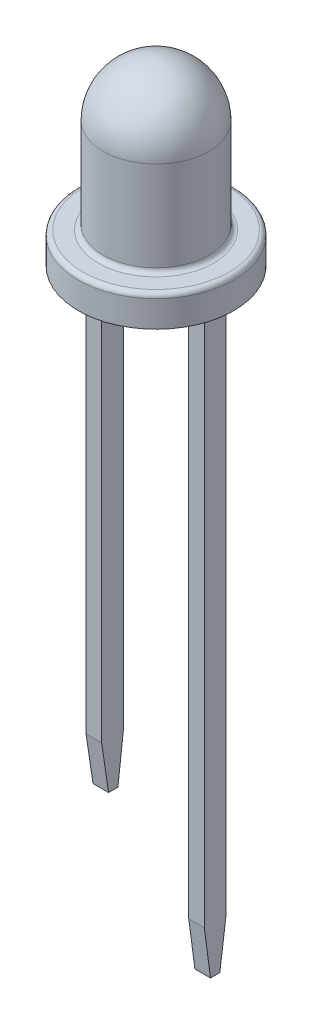
from build123d import *

# Parameters (mm, degrees)
BOSS_EXTRUDE1_DEPTH = 0.35
BOSS_EXTRUDE2_DEPTH = 0.35
CUT_EXTRUDE1_DEPTH  = 0.7
CUT_EXTRUDE2_DEPTH  = 0.7


with BuildPart() as part:
    # Sketch1 → Boss-Extrude1 (new, symmetric)
    with BuildSketch(Plane.XY):
        with BuildLine():
            Line((0, 0), (0, 19.4))
            ThreePointArc((0, 19.4), (-0.029289322, 19.470710678), (-0.1, 19.5))
            Line((-0.1, 19.5), (-0.4, 19.5))
            ThreePointArc((-0.4, 19.5), (-0.470710678, 19.529289322), (-0.5, 19.6))
            Line((-0.5, 19.6), (-0.5, 20.5))
            Line((-0.5, 20.5), (-0.5, 21))
            Line((-0.5, 21), (-1, 21))
            Line((-1, 21), (-1, 20.5))
            Line((-1, 20.5), (-2, 19.5))
            Line((-2, 19.5), (-1.1, 19.5))
            ThreePointArc((-1.1, 19.5), (-1.029289322, 19.470710678), (-1, 19.4))
            Line((-1, 19.4), (-1, 19.1))
            ThreePointArc((-1, 19.1), (-0.970710678, 19.029289322), (-0.9, 19))
            Line((-0.9, 19), (-0.6, 19))
            ThreePointArc((-0.6, 19), (-0.529289322, 18.970710678), (-0.5, 18.9))
            Line((-0.5, 18.9), (-0.5, 0))
            Line((-0.5, 0), (0, 0))
        make_face()
    extrude(amount=BOSS_EXTRUDE1_DEPTH, both=True)


with BuildPart() as body_2:
    # Sketch2 → Boss-Extrude2 (new, symmetric)
    with BuildSketch(Plane.XY):
        with BuildLine():
            Line((-2.270710678, 19.529289322), (-1.329289322, 20.470710678))
            ThreePointArc((-1.329289322, 20.470710678), (-1.307612047, 20.503153013), (-1.3, 20.541421356))
            Line((-1.3, 20.541421356), (-1.3, 21))
            Line((-1.3, 21), (-3.3, 21))
            Line((-3.3, 21), (-3.3, 19.6))
            ThreePointArc((-3.3, 19.6), (-3.329289322, 19.529289322), (-3.4, 19.5))
            Line((-3.4, 19.5), (-3.7, 19.5))
            ThreePointArc((-3.7, 19.5), (-3.770710678, 19.470710678), (-3.8, 19.4))
            Line((-3.8, 19.4), (-3.8, 3.5))
            Line((-3.8, 3.5), (-3.3, 3.5))
            Line((-3.3, 3.5), (-3.3, 18.817329295))
            ThreePointArc((-3.3, 18.817329295), (-3.270710678, 18.888039973), (-3.2, 18.917329295))
            Line((-3.2, 18.917329295), (-2.9, 18.917329295))
            ThreePointArc((-2.9, 18.917329295), (-2.829289322, 18.946618617), (-2.8, 19.017329295))
            Line((-2.8, 19.017329295), (-2.8, 19.4))
            ThreePointArc((-2.8, 19.4), (-2.770710678, 19.470710678), (-2.7, 19.5))
            Line((-2.7, 19.5), (-2.341421356, 19.5))
            ThreePointArc((-2.341421356, 19.5), (-2.303153013, 19.507612047), (-2.270710678, 19.529289322))
        make_face()
    extrude(amount=BOSS_EXTRUDE2_DEPTH, both=True)


with BuildPart() as cut_revolve2_tool:
    # Sketch3 → Cut-Revolve2 (revolve)
    with BuildSketch(Plane.XY):
        with BuildLine():
            Line((-1.187247292, 20.854394701), (-1.187247292, 21.16036165))
            Line((-1.187247292, 21.16036165), (-0.687247292, 21.037131329))
            ThreePointArc((-0.687247292, 21.037131329), (-0.920585717, 20.900173974), (-1.187247292, 20.854394701))
        make_face()
    revolve(axis=Axis((-1.187247292, 20.854394701, 0), (0, 1, 0)))


with BuildPart() as part_1:
    add(part.part)

    # Cut-Revolve2: cut by cut_revolve2_tool
    add(cut_revolve2_tool.part, mode=Mode.SUBTRACT)



with BuildPart() as body_2_1:
    add(body_2.part)

    # Cut-Revolve2: cut by cut_revolve2_tool
    add(cut_revolve2_tool.part, mode=Mode.SUBTRACT)


with BuildPart() as part_2:
    add(part_1.part)

    add(body_2_1.part)  # Revolve2 merges body 2
    # Sketch5 → Revolve2 (revolve)
    with BuildSketch(Plane.XY):
        with BuildLine():
            Line((-1.187247292, 20.967936142), (-1.187247292, 20.854394701))
            ThreePointArc((-1.187247292, 20.854394701), (-0.920585717, 20.900173974), (-0.687247292, 21.037131329))
            add(Edge.make_bspline(
                [(-1.187247292, 20.967936142), (-1.018996559, 20.969146878), (-0.855677822, 21.018217253), (-0.687247292, 21.037131329)],
                knots=[0, 0, 0, 0, 1, 1, 1, 1], degree=3))
        make_face()
    revolve(axis=Axis((-1.187247292, 20.967936142, 0), (0, -1, 0)))

    # Sketch8 → Cut-Extrude1 (cut)
    with BuildSketch(Plane(origin=(0, 0, 0), x_dir=(0, 0, -1), z_dir=(1, 0, 0))):
        Polygon((0.35, 1.5), (0.15, 0), (0.35, 0), align=None)
        Polygon((-0.35, 0), (-0.15, 0), (-0.35, 1.5), align=None)
    extrude(amount=-CUT_EXTRUDE1_DEPTH, mode=Mode.SUBTRACT)

    # Sketch9 → Cut-Extrude2 (cut)
    with BuildSketch(Plane.ZY.offset(3.8)):
        Polygon((-0.35, 3.5), (-0.173947539, 3.5), (-0.35, 5), align=None)
        Polygon((0.35, 5), (0.126052461, 3.5), (0.35, 3.5), align=None)
    extrude(amount=-CUT_EXTRUDE2_DEPTH, mode=Mode.SUBTRACT)


with BuildPart() as body_2_2:
    # Sketch7 → Revolve6 (revolve)
    with BuildSketch(Plane.XY, mode=Mode.PRIVATE) as revolve6_sk:
        with BuildLine():
            Line((-0.195111941, 22.838026568), (-0.195111941, 19.95))
            ThreePointArc((-0.195111941, 19.95), (-0.151177958, 19.843933983), (-0.045111941, 19.8))
            Line((-0.045111941, 19.8), (0.45, 19.8))
            ThreePointArc((0.45, 19.8), (0.556066017, 19.756066017), (0.6, 19.65))
            Line((0.6, 19.65), (0.6, 18.8))
            Line((0.6, 18.8), (-1.9, 18.8))
            Line((-1.9, 18.8), (-1.9, 24.533124413))
            ThreePointArc((-1.9, 24.533124413), (-0.696489712, 24.038669369), (-0.195111941, 22.838026568))
        make_face()
    revolve(revolve6_sk.sketch.rotate(Axis((-1.9, 18.8, 0), (0, 1, 0)), 90), axis=Axis((-1.9, 18.8, 0), (0, 1, 0)))


solid = Compound([part_2.part, body_2_2.part])
